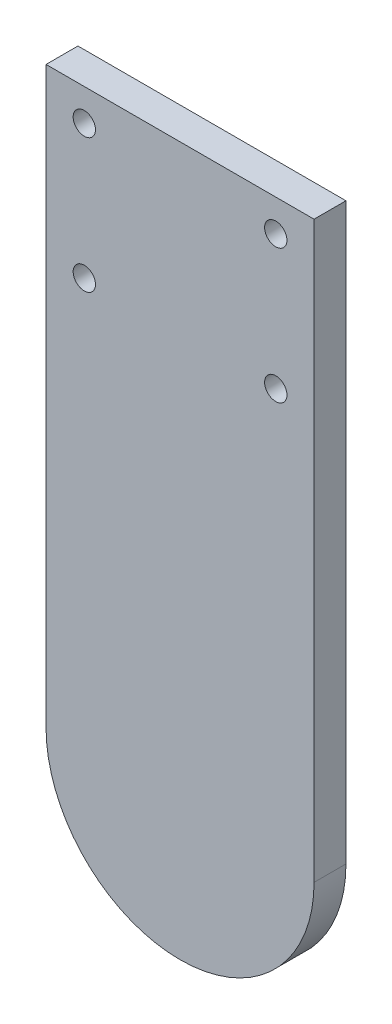
from build123d import *

# Parameters (mm, degrees)
BOSS_EXTRUDE1_DEPTH = 5
SKETCH2_R           = 1.75
CUT_EXTRUDE1_DEPTH  = 93.552687697
SKETCH3_R           = 4
CUT_EXTRUDE2_DEPTH  = 3
BOSS_EXTRUDE2_START = 1
SKETCH4_R           = 6
SKETCH4_R_2         = 4
BOSS_EXTRUDE2_DEPTH = 1


with BuildPart() as part:
    # Sketch1 → Boss-Extrude1 (new body)
    with BuildSketch(Plane.XY):
        with BuildLine():
            Line((-21, 0), (-21, 90))
            Line((-21, 90), (21, 90))
            Line((21, 90), (21, 0))
            ThreePointArc((21, 0), (0, -21), (-21, 0))
        make_face()
    extrude(amount=BOSS_EXTRUDE1_DEPTH)

    # Sketch2 → Cut-Extrude1 (cut, through all)
    with BuildSketch(Plane(origin=(0, 0, 0), x_dir=(-1, 0, 0), z_dir=(0, 0, -1))):
        with Locations((-15, 85)):
            Circle(SKETCH2_R)
        with Locations((-15, 64)):
            Circle(SKETCH2_R)
        with Locations(Location((15, 64, 0), (0, 0, 180))):
            Circle(SKETCH2_R)
        with Locations(Location((15, 85, 0), (0, 0, 180))):
            Circle(SKETCH2_R)
    extrude(amount=-CUT_EXTRUDE1_DEPTH, mode=Mode.SUBTRACT)

    # Sketch3 → Cut-Extrude2 (cut)
    with BuildSketch(Plane(origin=(0, 0, 0), x_dir=(-1, 0, 0), z_dir=(0, 0, -1))):
        Circle(SKETCH3_R)
    extrude(amount=-CUT_EXTRUDE2_DEPTH, mode=Mode.SUBTRACT)

    # Sketch4 → Boss-Extrude2 (add)
    with BuildSketch(Plane(origin=(0, 0, 0), x_dir=(-1, 0, 0), z_dir=(0, 0, -1)).offset(BOSS_EXTRUDE2_START)):
        with Locations(Location((0, 0, 0), (0, 0, 180))):
            Circle(SKETCH4_R)
        Circle(SKETCH4_R_2, mode=Mode.SUBTRACT)
    extrude(amount=-BOSS_EXTRUDE2_DEPTH)


solid = part.part
